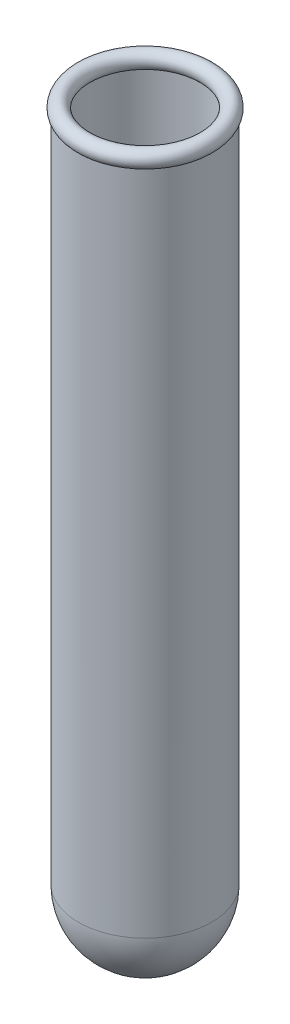
from build123d import *


with BuildPart() as part:
    # Sketch1 → Revolve1 (revolve)
    with BuildSketch(Plane.XY, mode=Mode.PRIVATE) as revolve1_sk:
        with BuildLine():
            ThreePointArc((0, -6), (4.242640687, -4.242640687), (6, 0))
            Line((6, 0), (6, 60))
            ThreePointArc((6, 60), (6.002835942, 61.115484437), (4.893341951, 61))
            ThreePointArc((4.893341951, 61), (4.754229922, 60.479474613), (5, 60))
            Line((5, 60), (5, 0))
            ThreePointArc((5, 0), (3.535533906, -3.535533906), (0, -5))
            Line((0, -5), (0, -6))
        make_face()
    revolve(revolve1_sk.sketch.rotate(Axis((0, 0, 0), (0, 1, 0)), 90), axis=Axis((0, 0, 0), (0, 1, 0)))


solid = part.part
